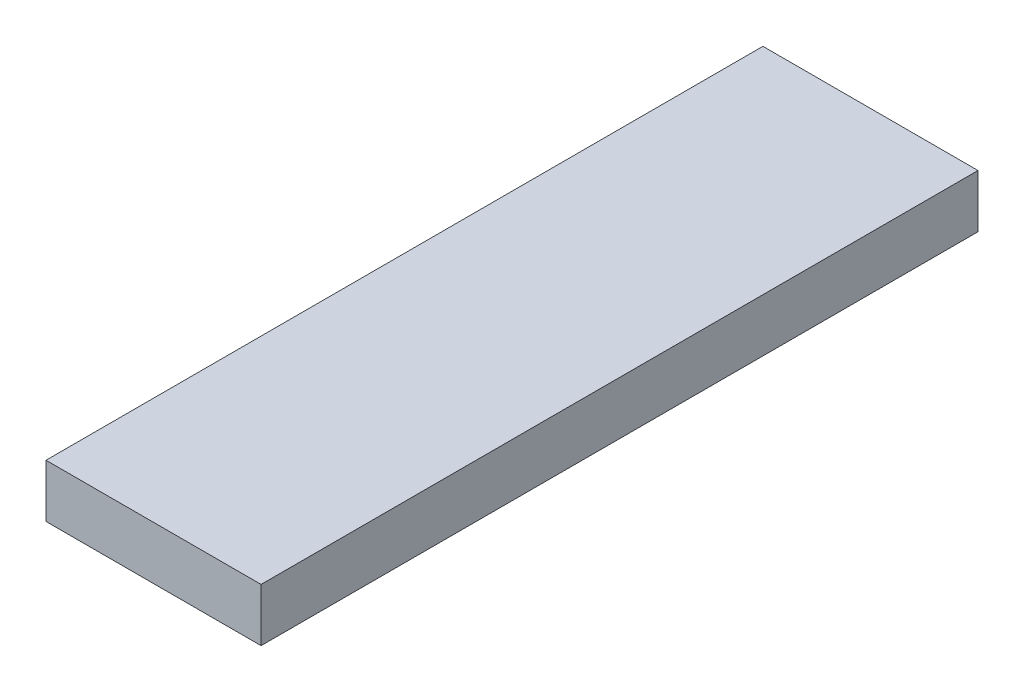
from build123d import *

# Parameters (mm, degrees)
SKETCH1_W      = 19.05
SKETCH1_H      = 63.5
EXTRUDE1_DEPTH = 4.699


with BuildPart() as part:
    # Sketch1 → Extrude1 (new body)
    with BuildSketch(Plane(origin=(0, 0, 0), x_dir=(1, 0, 0), z_dir=(0, 1, 0))):
        with Locations((9.525, 31.75)):
            Rectangle(SKETCH1_W, SKETCH1_H)
    extrude(amount=EXTRUDE1_DEPTH)


solid = part.part
